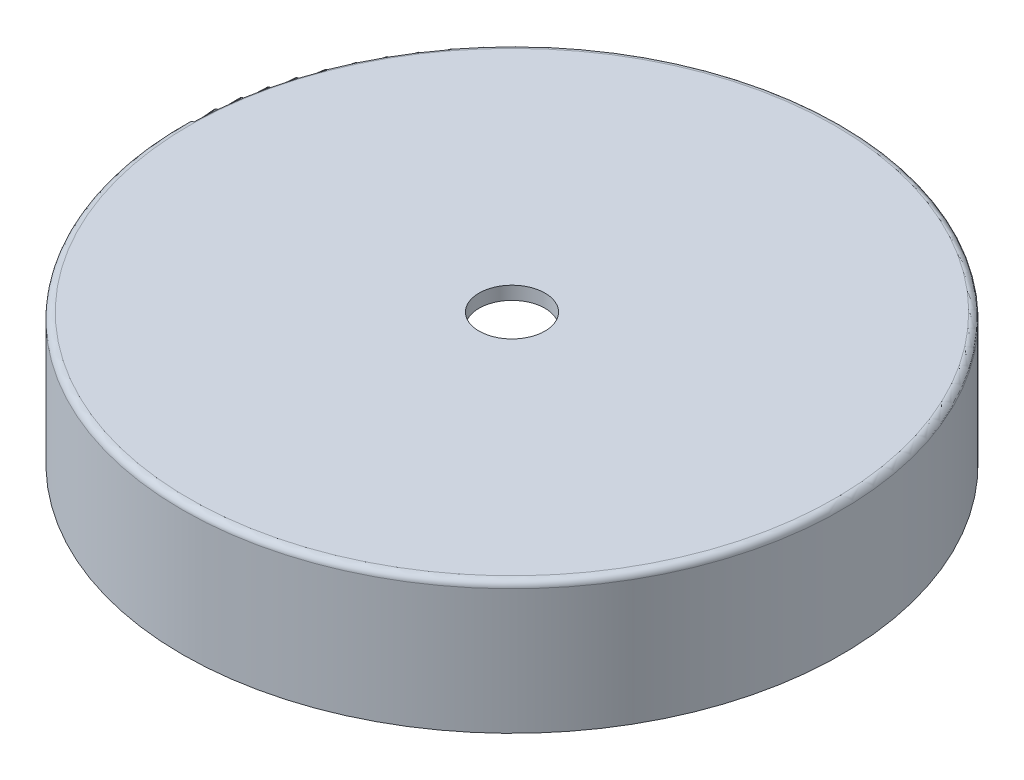
from build123d import *

# Parameters (mm, degrees)
CONG_1_R                = 0.5
ESQUISSE2_R             = 2.5
ENL_V_MAT_EXTRU_1_DEPTH = 10


with BuildPart() as part:
    # Esquisse1 → Révolution1 (revolve)
    with BuildSketch(Plane(origin=(0, 0, 0), x_dir=(0, 0, -1), z_dir=(1, 0, 0)), mode=Mode.PRIVATE) as r_volution1_sk:
        Polygon((0, 10), (-25, 10), (-25, 0), (-22, 0), (-22, 9), (0, 9), align=None)
    revolve(r_volution1_sk.sketch.rotate(Axis((0, 0, 0), (0, 1, 0)), 180), axis=Axis((0, 0, 0), (0, 1, 0)))

    # Congé1
    cong_1_edges = [part.edges().sort_by_distance(p)[0] for p in [
        (0, 9, 22),
        (0, 10, 25),
    ]]
    fillet(cong_1_edges, radius=CONG_1_R)

    # Esquisse2 → Enlèv. mat.-Extru.1 (cut)
    with BuildSketch(Plane(origin=(0, 10, 0), x_dir=(1, 0, 0), z_dir=(0, 1, 0))):
        with Locations(Location((0, 0, 0), (0, 0, 270))):
            Circle(ESQUISSE2_R)
    extrude(amount=-ENL_V_MAT_EXTRU_1_DEPTH, mode=Mode.SUBTRACT)


solid = part.part
